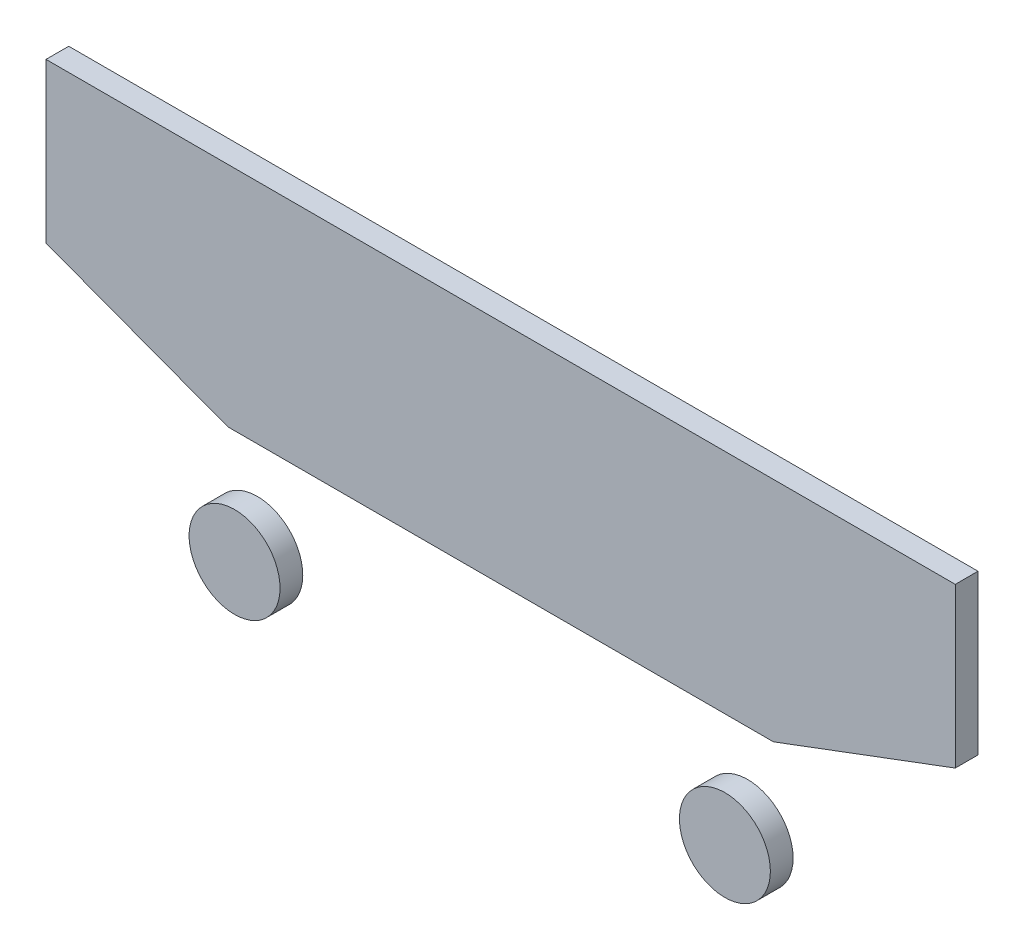
from build123d import *

# Parameters (mm, degrees)
SKETCH1_R             = 10
BOSS_EXTRUDE1_DEPTH   = 5
BOSS_EXTRUDE1_2_DEPTH = 5
BOSS_EXTRUDE1_3_DEPTH = 5


with BuildPart() as part:
    # Sketch1 → Boss-Extrude1 (new body)
    with BuildSketch(Plane.XY):
        with Locations((0, 10)):
            Circle(SKETCH1_R)
    extrude(amount=BOSS_EXTRUDE1_DEPTH)


with BuildPart() as body_2:
    # Sketch1 → Boss-Extrude1 2 (new body)
    with BuildSketch(Plane.XY):
        with Locations((107.850406647, 10)):
            Circle(SKETCH1_R)
    extrude(amount=BOSS_EXTRUDE1_2_DEPTH)


with BuildPart() as body_3:
    # Sketch1 → Boss-Extrude1 3 (new body)
    with BuildSketch(Plane.XY):
        Polygon((158.522615343, 85), (-41.477384657, 85), (-41.477384657, 50), (-1.477384657, 35), (118.522615343, 35), (158.522615343, 50), align=None)
    extrude(amount=BOSS_EXTRUDE1_3_DEPTH)


solid = Compound([part.part, body_2.part, body_3.part])
